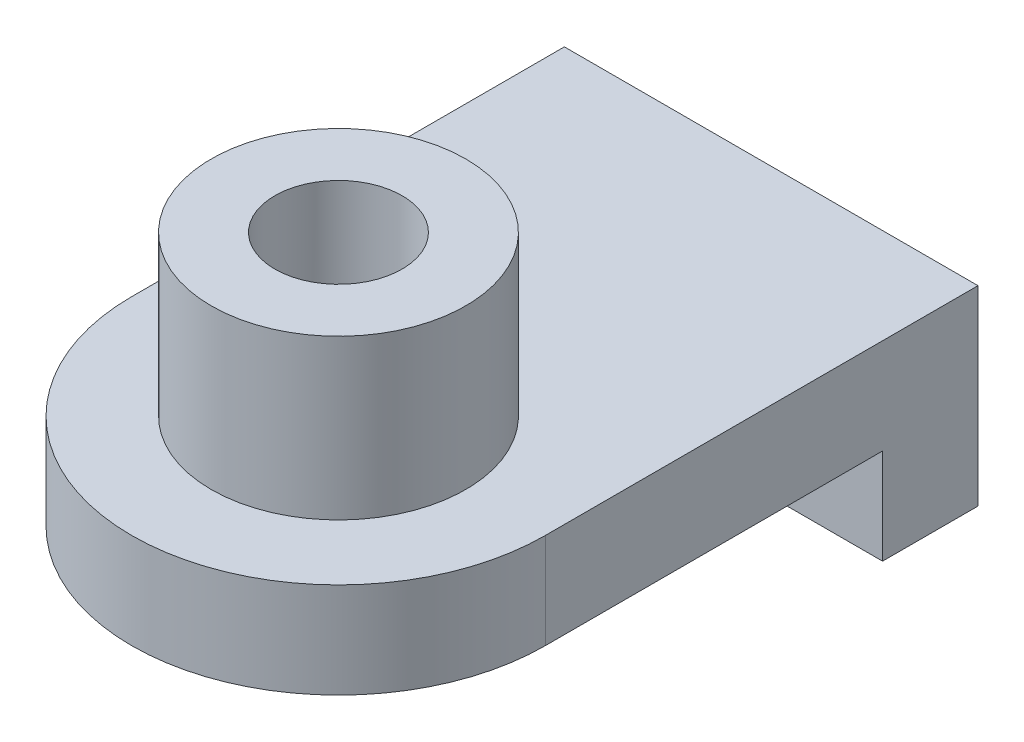
from build123d import *

# Parameters (mm, degrees)
EXTRUDE_1_DEPTH     = 15
SKETCH2_W           = 15
SKETCH2_H           = 15
EXTRUDE_2_DEPTH     = 65
SKETCH3_R           = 20
EXTRUDE_3_DEPTH     = 25
HOLE_WIZARD_1_D     = 20
HOLE_WIZARD_1_DEPTH = 25


with BuildPart() as part:
    # Sketch1 → 填料-伸長1 (new body)
    with BuildSketch(Plane(origin=(0, 0, 0), x_dir=(1, 0, 0), z_dir=(0, 1, 0))):
        with BuildLine():
            Line((32.5, 0), (32.5, 68))
            Line((32.5, 68), (-32.5, 68))
            Line((-32.5, 68), (-32.5, 0))
            ThreePointArc((-32.5, 0), (0, -32.5), (32.5, 0))
        make_face()
    extrude(amount=EXTRUDE_1_DEPTH)

    # Sketch2 → 填料-伸長2 (add, through all)
    with BuildSketch(Plane(origin=(32.5, 0, 0), x_dir=(0, 0, -1), z_dir=(1, 0, 0))):
        with Locations((60.5, -7.5)):
            Rectangle(SKETCH2_W, SKETCH2_H)
    extrude(amount=-EXTRUDE_2_DEPTH)

    # Sketch3 → 填料-伸長3 (add)
    with BuildSketch(Plane(origin=(0, 15, 0), x_dir=(-1, 0, 0), z_dir=(0, 1, 0))):
        with Locations(Location((0, 0, 0), (0, 0, 270))):
            Circle(SKETCH3_R)
    extrude(amount=EXTRUDE_3_DEPTH)

    # 鑽孔1
    with Locations(Plane(origin=(0, 40, 0), x_dir=(-1, 0, 0), z_dir=(0, 1, 0))):
        with Locations((0, 0)):
            Hole(HOLE_WIZARD_1_D / 2, depth=HOLE_WIZARD_1_DEPTH)


solid = part.part
